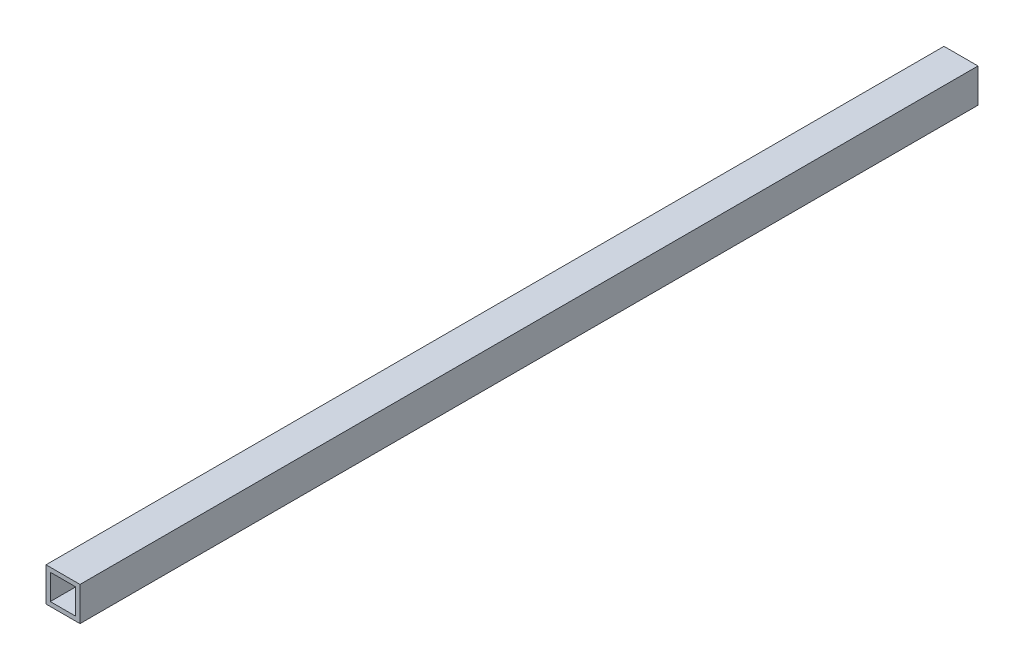
from build123d import *

# Parameters (mm, degrees)
SKETCH1_W           = 12.12
SKETCH1_H           = 12.12
SKETCH1_W_2         = 9.06
SKETCH1_H_2         = 9.06
BOSS_EXTRUDE1_DEPTH = 160


with BuildPart() as part:
    # Sketch1 → Boss-Extrude1 (new, symmetric)
    with BuildSketch(Plane.XY):
        Rectangle(SKETCH1_W, SKETCH1_H)
        Rectangle(SKETCH1_W_2, SKETCH1_H_2, mode=Mode.SUBTRACT)
    extrude(amount=BOSS_EXTRUDE1_DEPTH, both=True)


solid = part.part
